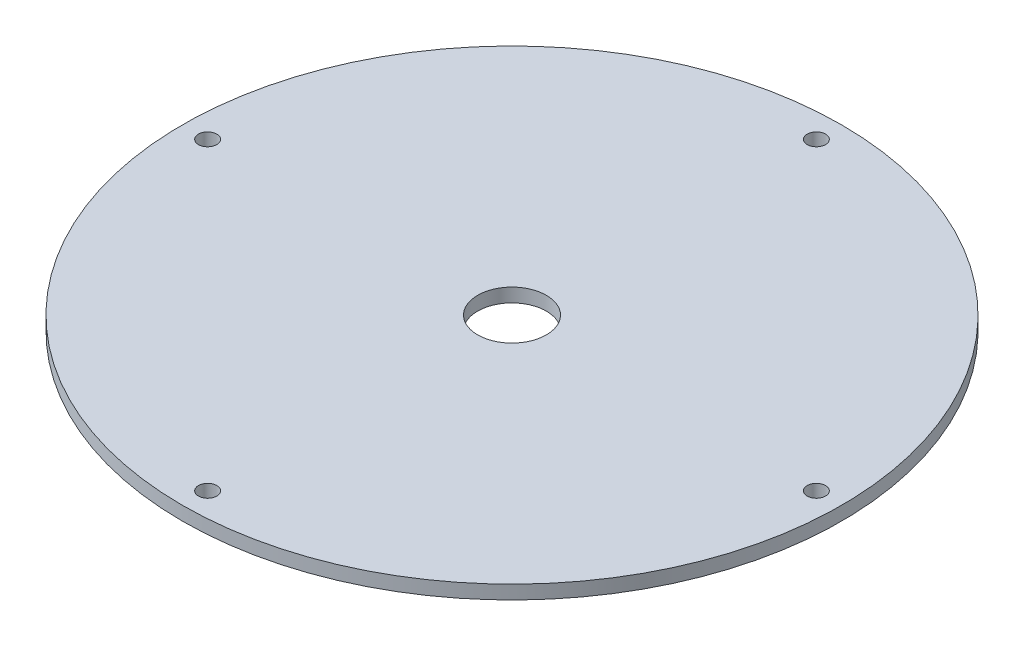
from build123d import *

# Parameters (mm, degrees)
SKETCH2_R           = 72
SKETCH2_R_2         = 7.5
SKETCH2_R_3         = 2
BOSS_EXTRUDE1_DEPTH = 3


with BuildPart() as part:
    # Sketch2 → Boss-Extrude1 (new body)
    with BuildSketch(Plane(origin=(0, 0, 0), x_dir=(1, 0, 0), z_dir=(0, 1, 0))):
        with Locations(Location((0, 0, 0), (0, 0, 270))):
            Circle(SKETCH2_R)
        with Locations(Location((0, 0, 0), (0, 0, 270))):
            Circle(SKETCH2_R_2, mode=Mode.SUBTRACT)
        with Locations(Location((0, 66.5, 0), (0, 0, 270))):
            Circle(SKETCH2_R_3, mode=Mode.SUBTRACT)
        with Locations(Location((66.5, 0, 0), (0, 0, 270))):
            Circle(SKETCH2_R_3, mode=Mode.SUBTRACT)
        with Locations(Location((0, -66.5, 0), (0, 0, 270))):
            Circle(SKETCH2_R_3, mode=Mode.SUBTRACT)
        with Locations(Location((-66.5, 0, 0), (0, 0, 270))):
            Circle(SKETCH2_R_3, mode=Mode.SUBTRACT)
    extrude(amount=BOSS_EXTRUDE1_DEPTH)


solid = part.part
